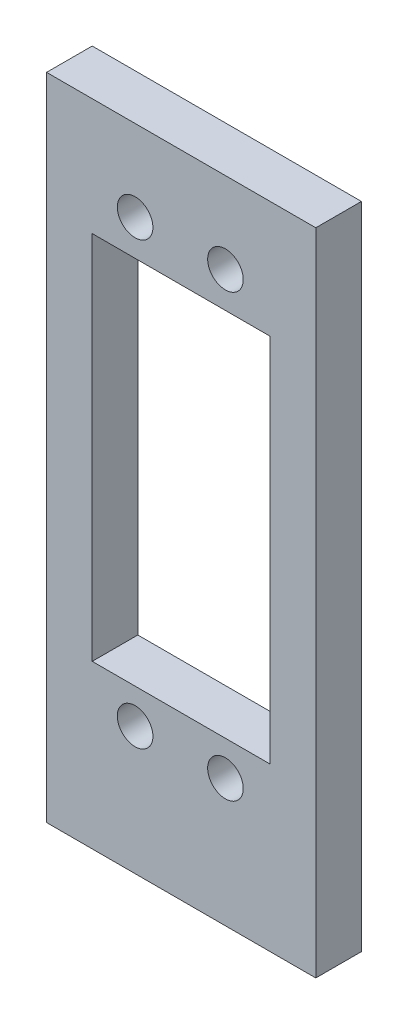
from build123d import *

# Parameters (mm, degrees)
CROQUIS1_W              = 19.5
CROQUIS1_H              = 40.6
SALIENTE_EXTRUIR2_DEPTH = 5
CROQUIS3_R              = 1.95
CORTAR_EXTRUIR1_DEPTH   = 10


with BuildPart() as part:
    # Croquis1 → Saliente-Extruir2 (new body)
    with BuildSketch(Plane.XY):
        Polygon((-14.75, 33.1), (14.75, 33.1), (14.75, 0), (14.75, -38.1), (-14.75, -38.1), (-14.75, 0), align=None)
        Rectangle(CROQUIS1_W, CROQUIS1_H, mode=Mode.SUBTRACT)
    extrude(amount=SALIENTE_EXTRUIR2_DEPTH)

    # Croquis3 → Cortar-Extruir1 (cut)
    with BuildSketch(Plane.XY.offset(5)):
        with Locations((-5.05, 24.2)):
            Circle(CROQUIS3_R)
        with Locations((4.85, 24.2)):
            Circle(CROQUIS3_R)
        with Locations((-5.05, -24.1)):
            Circle(CROQUIS3_R)
        with Locations((4.85, -24.1)):
            Circle(CROQUIS3_R)
    extrude(amount=-CORTAR_EXTRUIR1_DEPTH, mode=Mode.SUBTRACT)


solid = part.part
